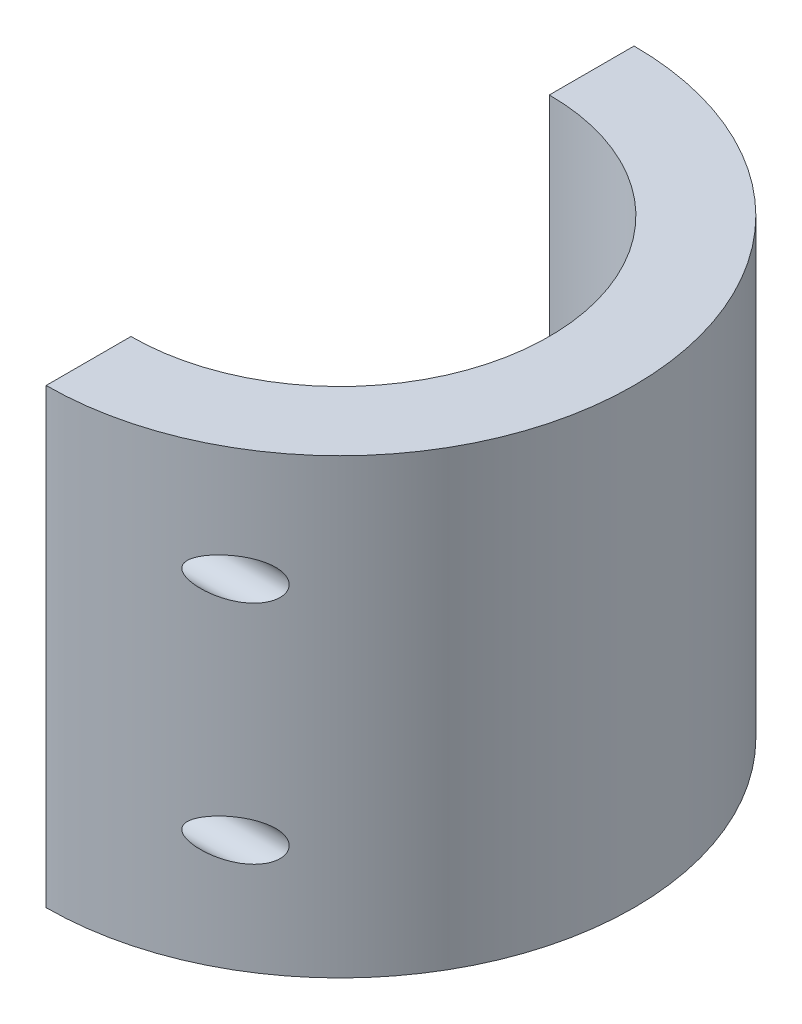
from build123d import *

# Parameters (mm, degrees)
BOSS_EXTRUDE1_DEPTH       = 20.32
TAP_DRILL_FOR_2_56_TAP1_D = 1.778


with BuildPart() as part:
    # Sketch1 → Boss-Extrude1 (new body)
    with BuildSketch(Plane(origin=(0, 0, 0), x_dir=(1, 0, 0), z_dir=(0, 1, 0))):
        with BuildLine():
            Line((0, 13.208), (0, 9.398))
            ThreePointArc((0, 9.398), (9.398, 0), (0, -9.398))
            Line((0, -9.398), (0, -13.208))
            ThreePointArc((0, -13.208), (13.208, 0), (0, 13.208))
        make_face()
    extrude(amount=BOSS_EXTRUDE1_DEPTH)

    # Tap Drill for #2-56 Tap1 (through all)
    with Locations(Plane(origin=(0, 15.24, -11.303), x_dir=(0, 0, -1), z_dir=(-1, 0, 0))):
        with Locations((0, 0), (-22.606, 0), (-22.606, 10.16), (0, 10.16)):
            Hole(TAP_DRILL_FOR_2_56_TAP1_D / 2)


solid = part.part
